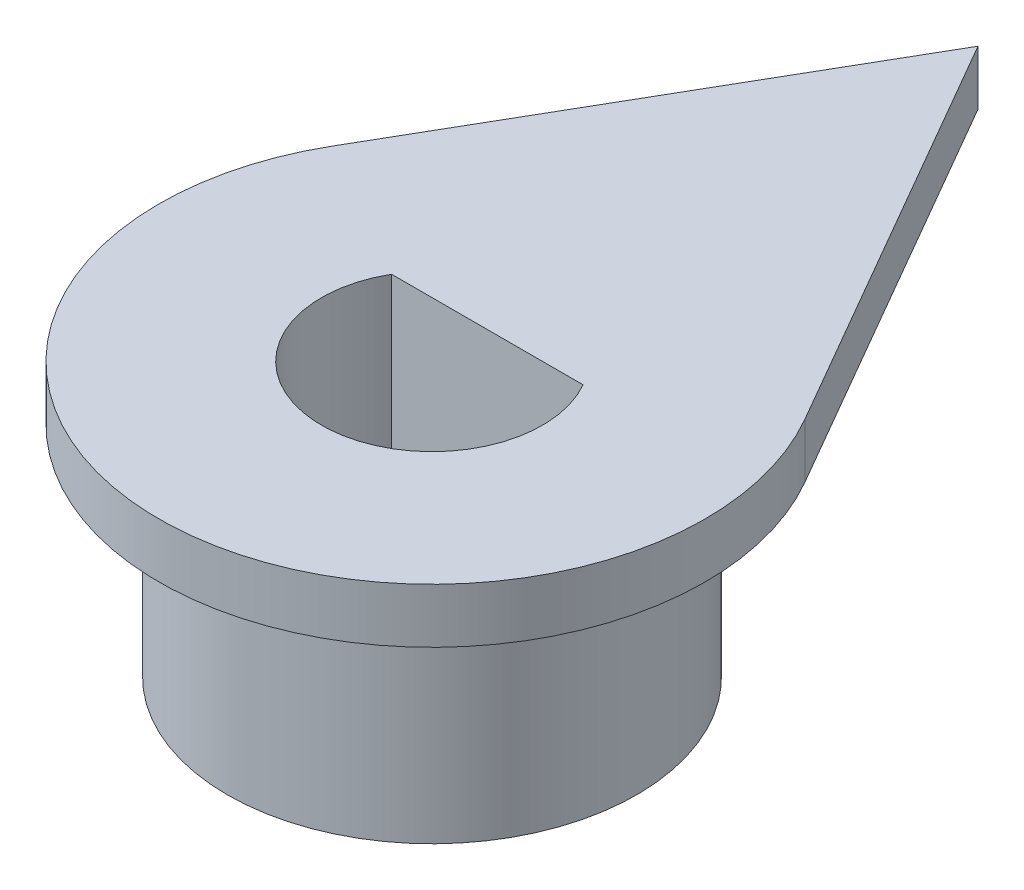
from build123d import *

# Parameters (mm, degrees)
SKETCH_1_R          = 7.5
SKETCH_1_R_2        = 4.05
EXTRUDE_1_DEPTH     = 10
EXTRUDE_START       = -2
SKETCH_2_R          = 4.05
EXTRUDE_2_DEPTH     = 2
EXTRUDE_3_DEPTH     = 10
SKETCH_4_R          = 1.45
CUT_EXTRUDE_1_DEPTH = 10


with BuildPart() as part:
    # 草图1 → 凸台-拉伸1 (new body)
    with BuildSketch(Plane(origin=(0, 0, 0), x_dir=(1, 0, 0), z_dir=(0, 1, 0))):
        with Locations(Location((0, 0, 0), (0, 0, 270))):
            Circle(SKETCH_1_R)
        with Locations(Location((0, 0, 0), (0, 0, 270))):
            Circle(SKETCH_1_R_2, mode=Mode.SUBTRACT)
    extrude(amount=EXTRUDE_1_DEPTH)

    # 草图2 → 凸台-拉伸2 (add)
    with BuildSketch(Plane(origin=(0, 10, 0), x_dir=(1, 0, 0), z_dir=(0, 1, 0)).offset(EXTRUDE_START)):
        with BuildLine():
            Line((-8.660254038, 5), (0, 20))
            Line((0, 20), (8.660254038, 5))
            ThreePointArc((8.660254038, 5), (0, -10), (-8.660254038, 5))
        make_face()
        with Locations(Location((0, 0, 0), (0, 0, 270))):
            Circle(SKETCH_2_R, mode=Mode.SUBTRACT)
    extrude(amount=EXTRUDE_2_DEPTH)

    # 草图3 → 凸台-拉伸3 (add)
    with BuildSketch(Plane.XZ):
        with BuildLine():
            Line((-3.507402885, -2.025), (3.507402885, -2.025))
            ThreePointArc((3.507402885, -2.025), (0, -4.05), (-3.507402885, -2.025))
        make_face()
    extrude(amount=-EXTRUDE_3_DEPTH)

    # 草图4 → 切除-拉伸1 (cut)
    with BuildSketch(Plane.XY):
        with Locations((0, 3.5)):
            Circle(SKETCH_4_R)
    extrude(amount=-CUT_EXTRUDE_1_DEPTH, mode=Mode.SUBTRACT)


solid = part.part
